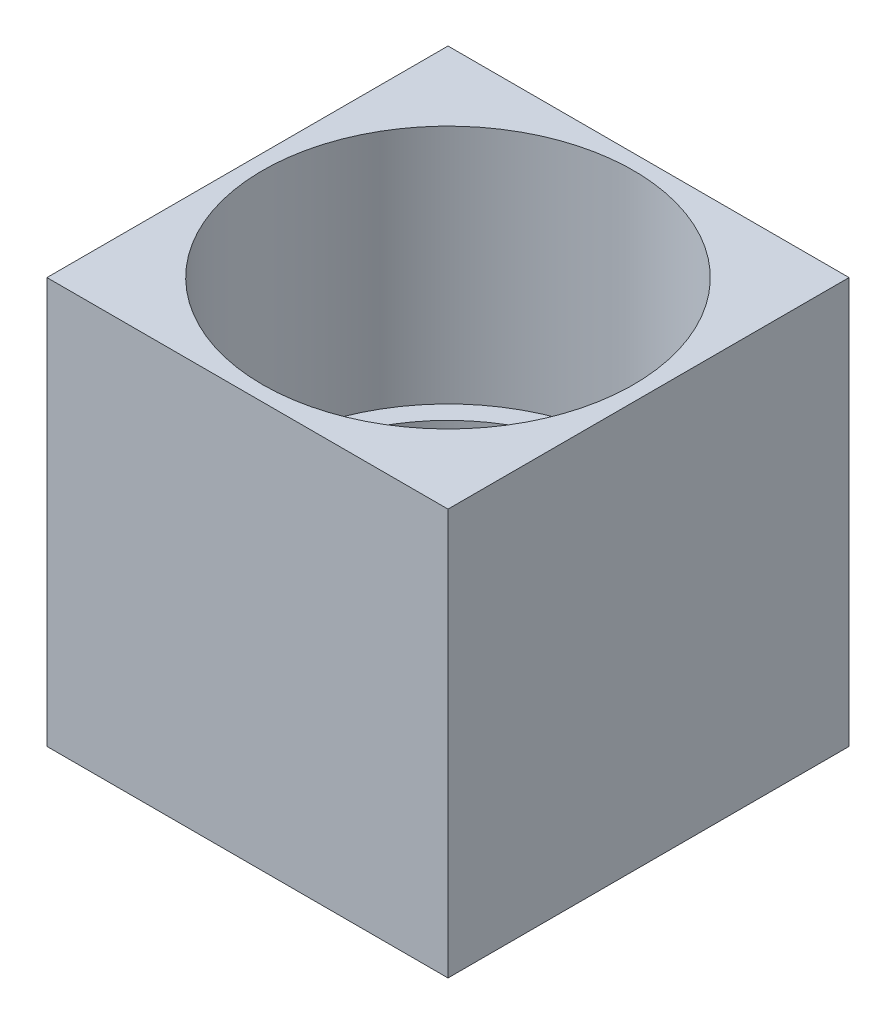
from build123d import *

# Parameters (mm, degrees)
SKETCH1_W           = 40
SKETCH1_H           = 40
BOSS_EXTRUDE1_DEPTH = 90
SKETCH2_R           = 18.5
CUT_EXTRUDE1_DEPTH  = 45
SKETCH3_R           = 16.5
CUT_EXTRUDE2_DEPTH  = 41
SKETCH4_W           = 40
SKETCH4_H           = 40
CUT_EXTRUDE3_DEPTH  = 21
SKETCH6_W           = 20
SKETCH6_H           = 15
CUT_EXTRUDE4_DEPTH  = 83.225300243
SKETCH8_W           = 20
SKETCH8_H           = 15
CUT_EXTRUDE5_DEPTH  = 83.225300243
SKETCH11_W          = 40
SKETCH11_H          = 28.5
CUT_EXTRUDE8_DEPTH  = 83.225300243


with BuildPart() as part:
    # Sketch1 → Boss-Extrude1 (new body)
    with BuildSketch(Plane(origin=(0, 0, 0), x_dir=(1, 0, 0), z_dir=(0, 1, 0))):
        Rectangle(SKETCH1_W, SKETCH1_H)
    extrude(amount=BOSS_EXTRUDE1_DEPTH)

    # Sketch2 → Cut-Extrude1 (cut)
    with BuildSketch(Plane(origin=(0, 90, 0), x_dir=(1, 0, 0), z_dir=(0, 1, 0))):
        with Locations(Location((0, 0, 0), (0, 0, 270))):
            Circle(SKETCH2_R)
    extrude(amount=-CUT_EXTRUDE1_DEPTH, mode=Mode.SUBTRACT)

    # Sketch3 → Cut-Extrude2 (cut)
    with BuildSketch(Plane(origin=(0, 45, 0), x_dir=(1, 0, 0), z_dir=(0, 1, 0))):
        with Locations(Location((0, 0, 0), (0, 0, 270))):
            Circle(SKETCH3_R)
    extrude(amount=-CUT_EXTRUDE2_DEPTH, mode=Mode.SUBTRACT)

    # Sketch4 → Cut-Extrude3 (cut)
    with BuildSketch(Plane(origin=(0, 90, 0), x_dir=(1, 0, 0), z_dir=(0, 1, 0))):
        Rectangle(SKETCH4_W, SKETCH4_H)
    extrude(amount=-CUT_EXTRUDE3_DEPTH, mode=Mode.SUBTRACT)

    # Sketch6 → Cut-Extrude4 (cut, through all)
    with BuildSketch(Plane.XY.offset(20)):
        with Locations((0, 15)):
            Rectangle(SKETCH6_W, SKETCH6_H)
    extrude(amount=-CUT_EXTRUDE4_DEPTH, mode=Mode.SUBTRACT)

    # Sketch8 → Cut-Extrude5 (cut, through all)
    with BuildSketch(Plane.ZY.offset(20)):
        with Locations((0, 15)):
            Rectangle(SKETCH8_W, SKETCH8_H)
    extrude(amount=-CUT_EXTRUDE5_DEPTH, mode=Mode.SUBTRACT)

    # Sketch11 → Cut-Extrude8 (cut, through all)
    with BuildSketch(Plane.XY.offset(20)):
        with Locations((0, 14.25)):
            Rectangle(SKETCH11_W, SKETCH11_H)
    extrude(amount=-CUT_EXTRUDE8_DEPTH, mode=Mode.SUBTRACT)


solid = part.part
